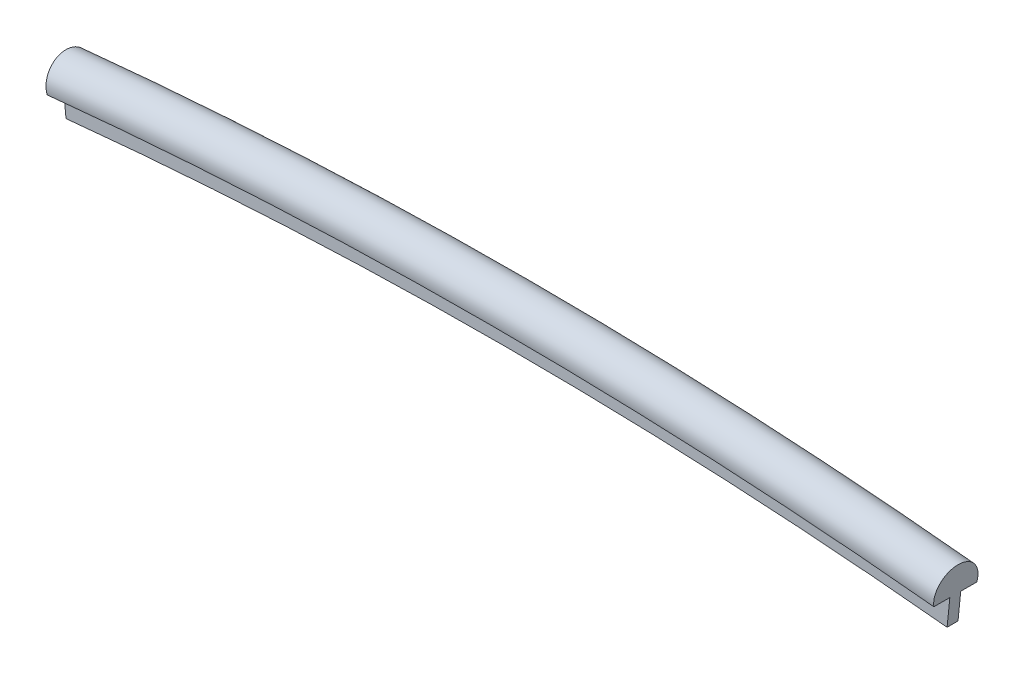
from build123d import *

# Parameters (mm, degrees)
REVOLVE1_ANGLE           = 5.799629493
REVOLVE1_OTHER_WAY_ANGLE = 5.799629493


with BuildPart() as part:
    # Sketch2 → Revolve1 (revolve)
    with BuildSketch(Plane(origin=(0, 0, 0), x_dir=(0, 0, -1), z_dir=(1, 0, 0))):
        with BuildLine():
            Line((0, 239.8), (0.3, 239.8))
            Line((0.3, 239.8), (0.3, 241.3))
            Line((0.3, 241.3), (1.18, 241.3))
            ThreePointArc((1.18, 241.3), (0, 242.800182019), (-1.18, 241.3))
            Line((-1.18, 241.3), (-0.3, 241.3))
            Line((-0.3, 241.3), (-0.3, 239.8))
            Line((-0.3, 239.8), (0, 239.8))
        make_face()
    revolve(axis=Axis((0, 0, 70.597641597), (0, 0, -1)), revolution_arc=REVOLVE1_ANGLE)

    # Sketch2 → Revolve1 other way (revolve)
    with BuildSketch(Plane(origin=(0, 0, 0), x_dir=(0, 0, -1), z_dir=(1, 0, 0))):
        with BuildLine():
            Line((0, 239.8), (0.3, 239.8))
            Line((0.3, 239.8), (0.3, 241.3))
            Line((0.3, 241.3), (1.18, 241.3))
            ThreePointArc((1.18, 241.3), (0, 242.800182019), (-1.18, 241.3))
            Line((-1.18, 241.3), (-0.3, 241.3))
            Line((-0.3, 241.3), (-0.3, 239.8))
            Line((-0.3, 239.8), (0, 239.8))
        make_face()
    revolve(axis=Axis((0, 0, 70.597641597), (0, 0, 1)), revolution_arc=REVOLVE1_OTHER_WAY_ANGLE)


solid = part.part
